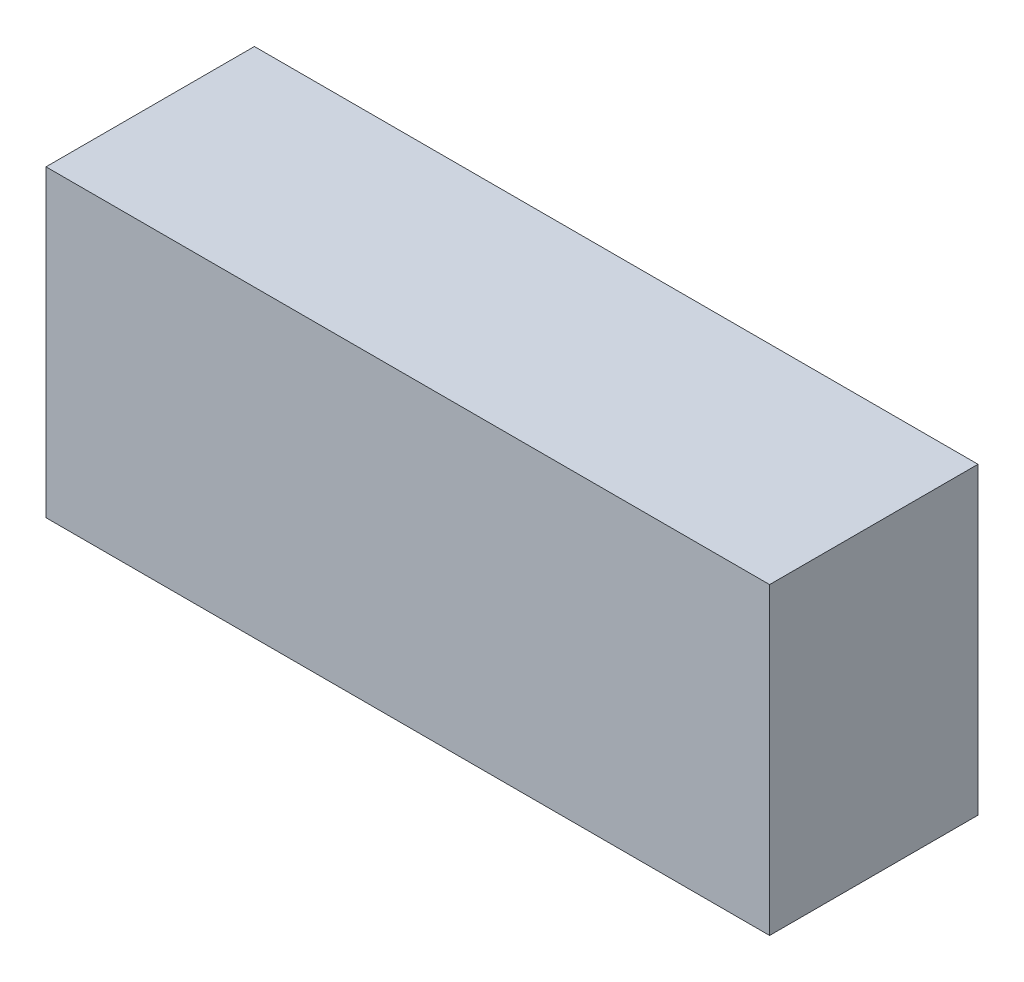
from build123d import *

# Parameters (mm, degrees)
SKETCH1_W           = 75
SKETCH1_H           = 31.5
BOSS_EXTRUDE1_DEPTH = 21.6


with BuildPart() as part:
    # Sketch1 → Boss-Extrude1 (new body)
    with BuildSketch(Plane.XY):
        Rectangle(SKETCH1_W, SKETCH1_H)
    extrude(amount=BOSS_EXTRUDE1_DEPTH)


solid = part.part
